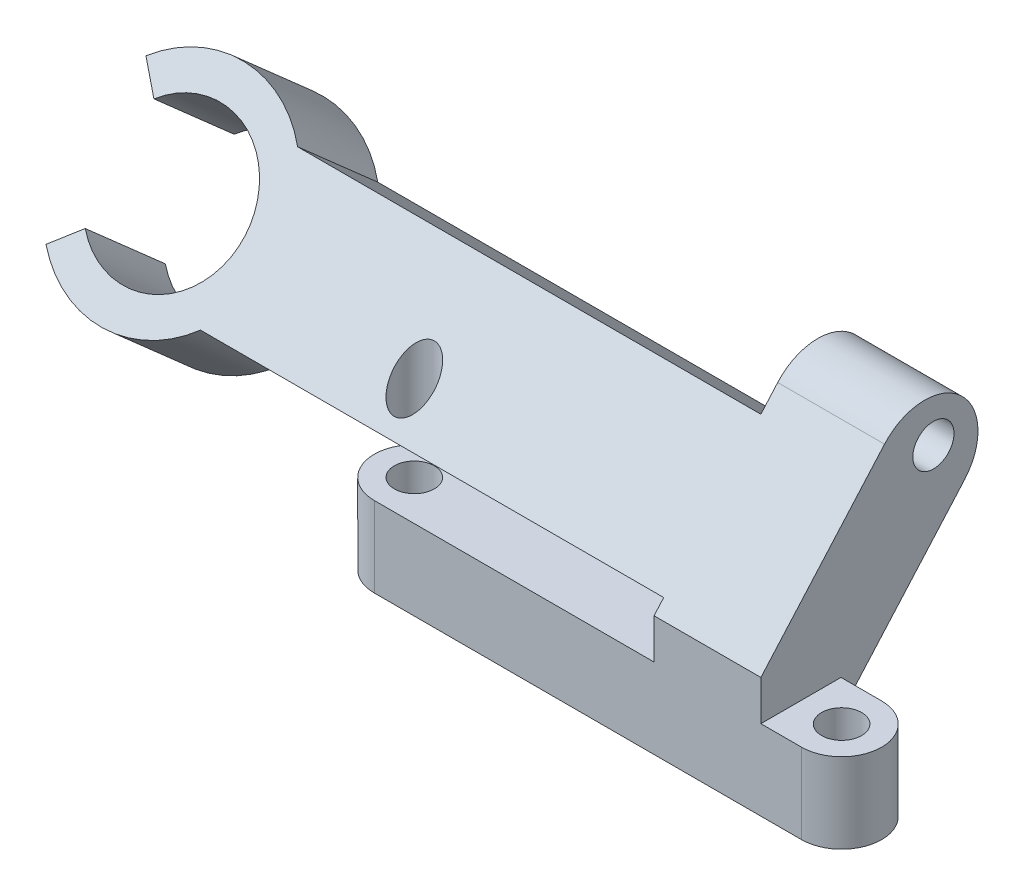
from build123d import *

# Parameters (mm, degrees)
SKETCH_1_R          = 1.5
EXTRUDE_2_DEPTH     = 6
SKETCH_1_4_W        = 8
SKETCH_1_4_H        = 6
EXTRUDE_3_DEPTH     = 3
EXTRUDE_28_DEPTH    = 8
SKETCH_8_R          = 1.542364341
CUT_EXTRUDE_2_DEPTH = 12
EXTRUDE_29_DEPTH    = 35
EXTRUDE_30_DEPTH    = 8
CUT_EXTRUDE_START   = -20
SKETCH_11_R         = 1.5
CUT_EXTRUDE_3_DEPTH = 20


with BuildPart() as part:
    # 草圖1 → 填料-伸長2 (new body)
    with BuildSketch(Plane(origin=(0, 0, 0), x_dir=(1, 0, 0), z_dir=(0, 1, 0))):
        with BuildLine():
            Line((-38.676968887, -3), (-6.676968887, -3))
            ThreePointArc((-6.676968887, -3), (-3.676968887, 0), (-6.676968887, 3))
            Line((-6.676968887, 3), (-38.676968887, 3))
            ThreePointArc((-38.676968887, 3), (-41.676968887, 0), (-38.676968887, -3))
        make_face()
        with Locations((-38.676968887, 0)):
            Circle(SKETCH_1_R, mode=Mode.SUBTRACT)
        with Locations((-6.676968887, 0)):
            Circle(SKETCH_1_R, mode=Mode.SUBTRACT)
    extrude(amount=-EXTRUDE_2_DEPTH)

    # 草圖1<4> → 填料-伸長3 (add)
    with BuildSketch(Plane(origin=(0, 0, 0), x_dir=(1, 0, 0), z_dir=(0, 1, 0))):
        with Locations((-13.722758256, 0)):
            Rectangle(SKETCH_1_4_W, SKETCH_1_4_H)
    extrude(amount=EXTRUDE_3_DEPTH)

    # 草圖3 → 填料-伸長28 (add)
    with BuildSketch(Plane(origin=(-9.722758256, 0, 0), x_dir=(0, 0, -1), z_dir=(1, 0, 0))):
        with BuildLine():
            Line((3, -2.291502622), (12.260129589, 8.208497378))
            ThreePointArc((12.260129589, 8.208497378), (11.9058809, 13.854248689), (6.260129589, 13.5))
            Line((6.260129589, 13.5), (-3, 3))
            Line((-3, 3), (3, -2.291502622))
        make_face()
    extrude(amount=-EXTRUDE_28_DEPTH)

    # 草圖8 → 除料-伸長2 (cut)
    with BuildSketch(Plane(origin=(-9.722758256, 0, 0), x_dir=(0, 0, -1), z_dir=(1, 0, 0))):
        with Locations((9.921567416, 11.604248689)):
            Circle(SKETCH_8_R)
    extrude(amount=-CUT_EXTRUDE_2_DEPTH, mode=Mode.SUBTRACT)

    # 草圖9 → 填料-伸長29 (add)
    with BuildSketch(Plane.ZY.offset(17.722758256)):
        Polygon((-10.999130047, 6.778658296), (-4.999130047, 12.070160919), (2.276686058, 3.820160919), (-3.723313942, -1.471341704), align=None)
    extrude(amount=EXTRUDE_29_DEPTH)

    # 草圖10 → 填料-伸長30 (add)
    with BuildSketch(Plane(origin=(0, -2.49076751, -2.824264888), x_dir=(-1, 0, 0), z_dir=(0, -0.6614378277661491, -0.7499999999999987))):
        with BuildLine():
            Line((62.111845553, 10.748321705), (63.879612506, 12.516088658))
            ThreePointArc((63.879612506, 12.516088658), (50.222758256, 6.859234408), (63.879612506, 1.202380159))
            Line((63.879612506, 1.202380159), (62.111845553, 2.970147112))
            ThreePointArc((62.111845553, 2.970147112), (52.722758256, 6.859234408), (62.111845553, 10.748321705))
        make_face()
    extrude(amount=-EXTRUDE_30_DEPTH)

    # 草圖11 → 除料-伸長3 (cut)
    with BuildSketch(Plane.XZ.offset(6).offset(CUT_EXTRUDE_START)):
        with Locations((-38.676968887, 0)):
            Circle(SKETCH_11_R)
    extrude(amount=CUT_EXTRUDE_3_DEPTH, mode=Mode.SUBTRACT)


solid = part.part
